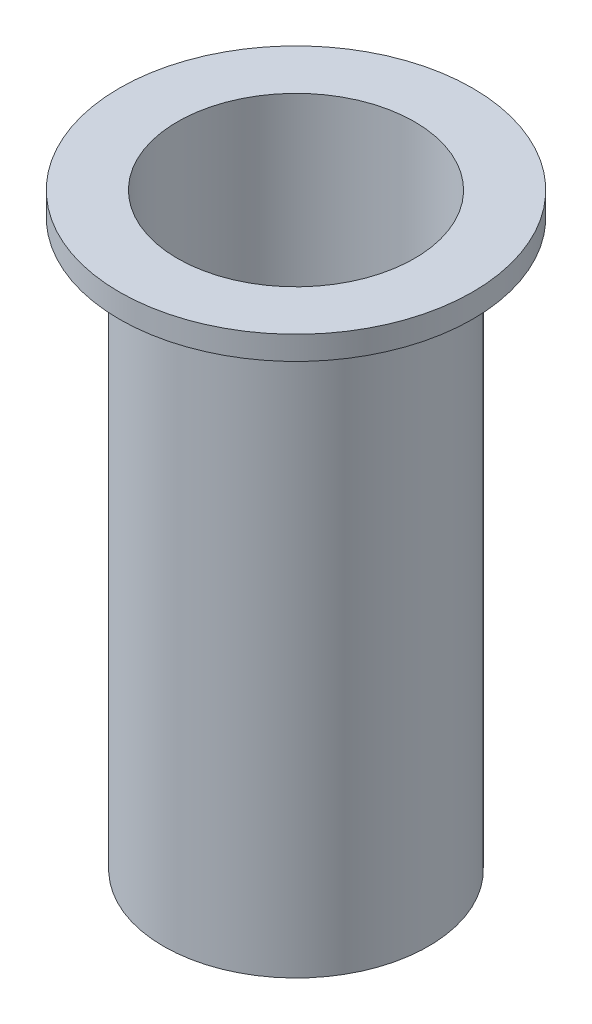
from build123d import *


with BuildPart() as part:
    # Shell Profile → Shell Revolve (revolve)
    with BuildSketch(Plane.XY, mode=Mode.PRIVATE) as shell_revolve_sk:
        Polygon((51.1302, 0), (51.1302, 254), (76.2, 254), (76.2, 243.84), (57.15, 243.84), (57.15, 0), align=None)
    revolve(shell_revolve_sk.sketch.rotate(Axis((0, 0, 0), (0, -1, 0)), 90), axis=Axis((0, 0, 0), (0, -1, 0)))


solid = part.part
